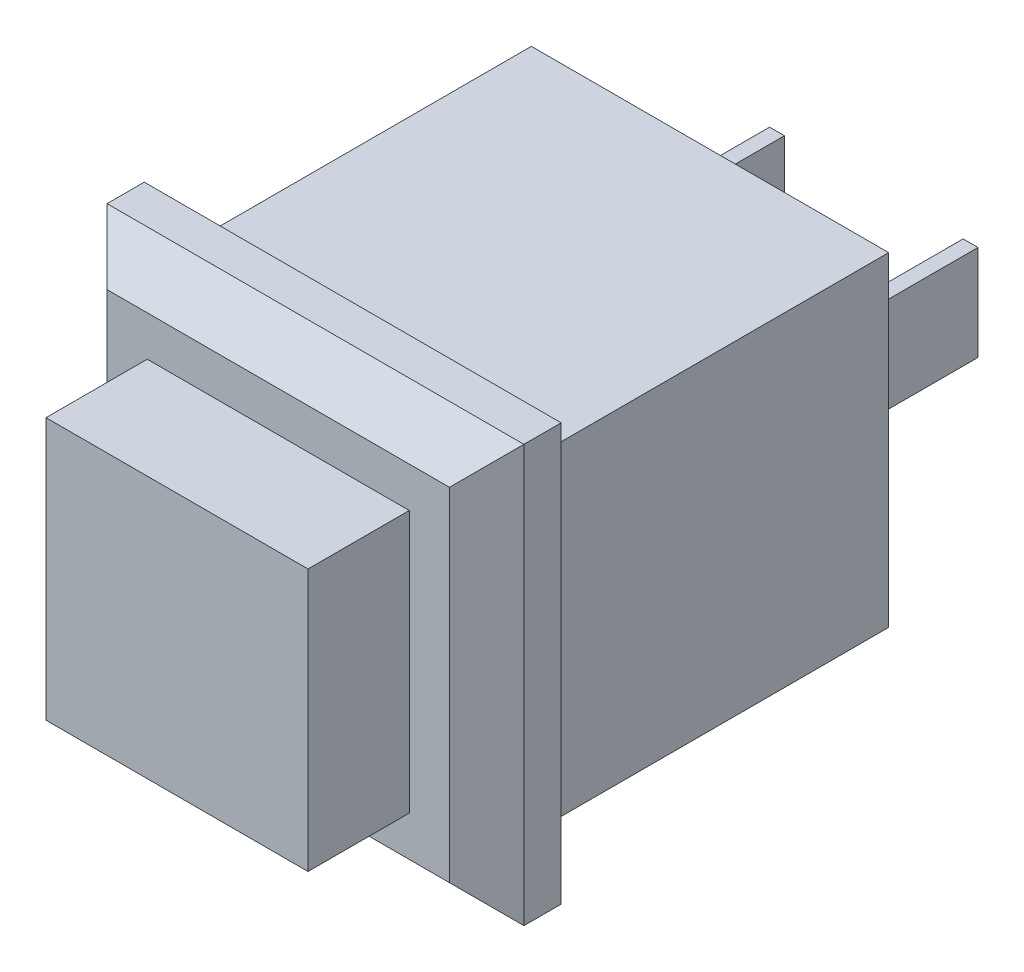
from build123d import *

# Parameters (mm, degrees)
SKETCH1_W           = 14
SKETCH1_H           = 14
BOSS_EXTRUDE1_DEPTH = 23.4
SKETCH2_W           = 14
SKETCH2_H           = 14
SKETCH2_W_2         = 8.8
SKETCH2_H_2         = 8.8
CUT_EXTRUDE1_DEPTH  = 3.4
SKETCH3_W           = 14
SKETCH3_H           = 14
SKETCH3_W_2         = 12
SKETCH3_H_2         = 10.9
CUT_EXTRUDE2_DEPTH  = 17.5
SKETCH4_W           = 12
SKETCH4_H           = 10.9
SKETCH4_W_2         = 0.5
SKETCH4_H_2         = 3.2
CUT_EXTRUDE3_DEPTH  = 5.5
CHAMFER1_SIZE       = 1.25


with BuildPart() as part:
    # Sketch1 → Boss-Extrude1 (new body)
    with BuildSketch(Plane.XY):
        Rectangle(SKETCH1_W, SKETCH1_H)
    extrude(amount=BOSS_EXTRUDE1_DEPTH)

    # Sketch2 → Cut-Extrude1 (cut)
    with BuildSketch(Plane.XY.offset(23.4)):
        Rectangle(SKETCH2_W, SKETCH2_H)
        Rectangle(SKETCH2_W_2, SKETCH2_H_2, mode=Mode.SUBTRACT)
    extrude(amount=-CUT_EXTRUDE1_DEPTH, mode=Mode.SUBTRACT)

    # Sketch3 → Cut-Extrude2 (cut)
    with BuildSketch(Plane(origin=(0, 0, 0), x_dir=(-1, 0, 0), z_dir=(0, 0, -1))):
        Rectangle(SKETCH3_W, SKETCH3_H)
        Rectangle(SKETCH3_W_2, SKETCH3_H_2, mode=Mode.SUBTRACT)
    extrude(amount=-CUT_EXTRUDE2_DEPTH, mode=Mode.SUBTRACT)

    # Sketch4 → Cut-Extrude3 (cut)
    with BuildSketch(Plane(origin=(0, 0, 0), x_dir=(-1, 0, 0), z_dir=(0, 0, -1))):
        Rectangle(SKETCH4_W, SKETCH4_H)
        with Locations((-3.25, 0)):
            Rectangle(SKETCH4_W_2, SKETCH4_H_2, mode=Mode.SUBTRACT)
        with Locations((3.25, 0)):
            Rectangle(SKETCH4_W_2, SKETCH4_H_2, mode=Mode.SUBTRACT)
    extrude(amount=-CUT_EXTRUDE3_DEPTH, mode=Mode.SUBTRACT)

    # Chamfer1
    chamfer1_edges = [part.edges().sort_by_distance(p)[0] for p in [
        (-7, 0, 20),
        (0, 7, 20),
        (7, 0, 20),
        (0, -7, 20),
    ]]
    chamfer(chamfer1_edges, length=CHAMFER1_SIZE)


solid = part.part
